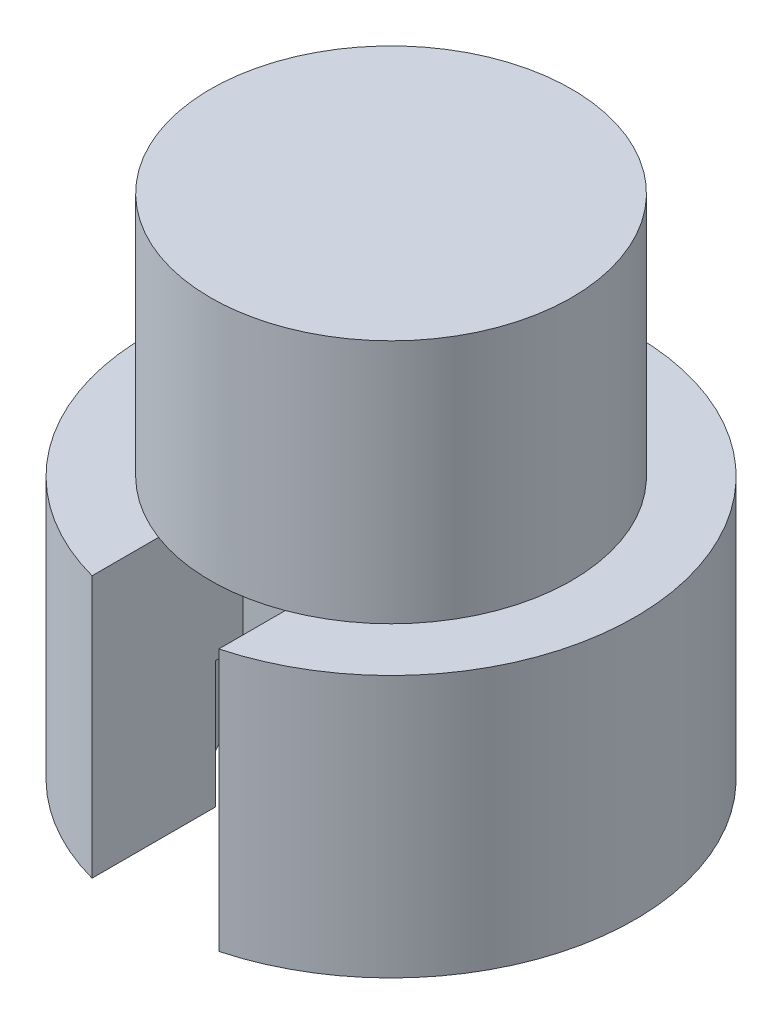
from build123d import *

# Parameters (mm, degrees)
SKETCH_1_R          = 4.275
EXTRUDE_1_DEPTH     = 12
SKETCH_3_R          = 5.775
EXTRUDE_2_DEPTH     = 6.2
SKETCH_2_R          = 3.05
CUT_EXTRUDE_1_DEPTH = 3
SKETCH_4_W          = 3
SKETCH_4_H          = 6.2
CUT_EXTRUDE_2_DEPTH = 4


with BuildPart() as part:
    # 草图1 → 凸台-拉伸1 (new body)
    with BuildSketch(Plane(origin=(0, 0, 0), x_dir=(1, 0, 0), z_dir=(0, 1, 0))):
        with Locations(Location((0, 0, 0), (0, 0, 270))):
            Circle(SKETCH_1_R)
    extrude(amount=EXTRUDE_1_DEPTH)

    # 草图3 → 凸台-拉伸2 (add)
    with BuildSketch(Plane.XZ):
        with Locations(Location((0, 0, 0), (0, 0, 270))):
            Circle(SKETCH_3_R)
    extrude(amount=-EXTRUDE_2_DEPTH)

    # 草图2 → 切除-拉伸1 (cut)
    with BuildSketch(Plane.XZ):
        with Locations(Location((0, 0, 0), (0, 0, 270))):
            Circle(SKETCH_2_R)
    extrude(amount=-CUT_EXTRUDE_1_DEPTH, mode=Mode.SUBTRACT)

    # 草图4 → 切除-拉伸2 (cut)
    with BuildSketch(Plane.XY.offset(6)):
        with Locations((0, 3.1)):
            Rectangle(SKETCH_4_W, SKETCH_4_H)
    extrude(amount=-CUT_EXTRUDE_2_DEPTH, mode=Mode.SUBTRACT)


solid = part.part
